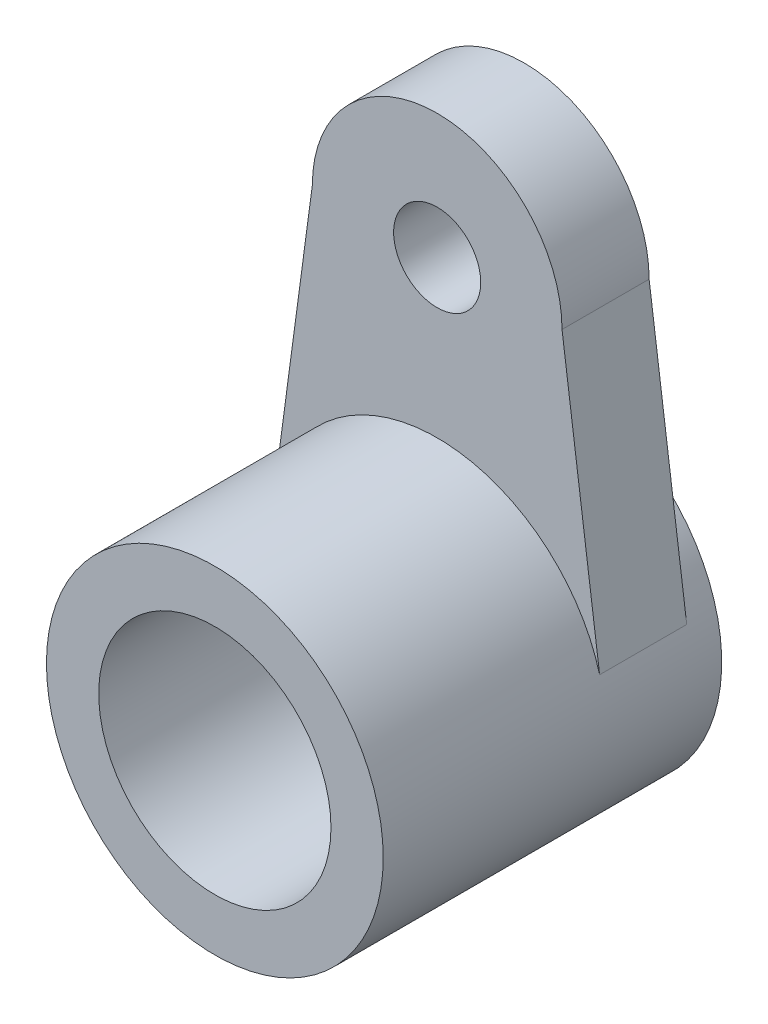
from build123d import *

# Parameters (mm, degrees)
EXTRUDE_1_DEPTH     = 1.5
SKETCH_3_R          = 2.9
EXTRUDE_2_DEPTH     = 3.829
EXTRUDE_START       = 0.5
SKETCH_4_R          = 2.9
EXTRUDE_3_DEPTH     = 0.5
SKETCH_5_R          = 2
CUT_EXTRUDE_1_DEPTH = 3
CUT_EXTRUDE_START   = -0.7
SKETCH_6_R          = 2
CUT_EXTRUDE_2_DEPTH = 0.7
SKETCH_7_R          = 1.1
CUT_EXTRUDE_3_DEPTH = 3.7
SKETCH_8_R          = 0.75
CUT_EXTRUDE_4_DEPTH = 3.7


with BuildPart() as part:
    # 草图1 → 凸台-拉伸1 (new body)
    with BuildSketch(Plane.XY):
        with BuildLine():
            Line((-2.15, 0), (-2.797439847, -4.825584994))
            ThreePointArc((-2.797439847, -4.825584994), (0, -8.49), (2.797439847, -4.825584994))
            Line((2.797439847, -4.825584994), (2.15, 0))
            ThreePointArc((2.15, 0), (0, 2.15), (-2.15, 0))
        make_face()
    extrude(amount=EXTRUDE_1_DEPTH)

    # 草图3 → 凸台-拉伸2 (add)
    with BuildSketch(Plane.XY.offset(1.5)):
        with Locations(Location((0, -5.59, 0), (0, 0, 164.716730752))):
            Circle(SKETCH_3_R)
    extrude(amount=EXTRUDE_2_DEPTH)

    # 草图4 → 凸台-拉伸3 (add)
    with BuildSketch(Plane(origin=(0, 0, 0), x_dir=(-1, 0, 0), z_dir=(0, 0, -1)).offset(EXTRUDE_START)):
        with Locations((0, -5.59)):
            Circle(SKETCH_4_R)
    extrude(amount=-EXTRUDE_3_DEPTH)

    # 草图5 → 切除-拉伸1 (cut)
    with BuildSketch(Plane.XY.offset(5.329)):
        with Locations((0, -5.59)):
            Circle(SKETCH_5_R)
    extrude(amount=-CUT_EXTRUDE_1_DEPTH, mode=Mode.SUBTRACT)

    # 草图6 → 切除-拉伸2 (cut)
    with BuildSketch(Plane(origin=(0, 0, -0.5), x_dir=(-1, 0, 0), z_dir=(0, 0, -1)).offset(CUT_EXTRUDE_START)):
        with Locations(Location((0, -5.59, 0), (0, 0, 180))):
            Circle(SKETCH_6_R)
    extrude(amount=CUT_EXTRUDE_2_DEPTH, mode=Mode.SUBTRACT)

    # 草图7 → 切除-拉伸3 (cut)
    with BuildSketch(Plane(origin=(0, 0, 0.2), x_dir=(-1, 0, 0), z_dir=(0, 0, -1))):
        with Locations((0, -5.59)):
            Circle(SKETCH_7_R)
    extrude(amount=-CUT_EXTRUDE_3_DEPTH, mode=Mode.SUBTRACT)

    # 草图8 → 切除-拉伸4 (cut)
    with BuildSketch(Plane.XY.offset(1.5)):
        Circle(SKETCH_8_R)
    extrude(amount=-CUT_EXTRUDE_4_DEPTH, mode=Mode.SUBTRACT)


solid = part.part
